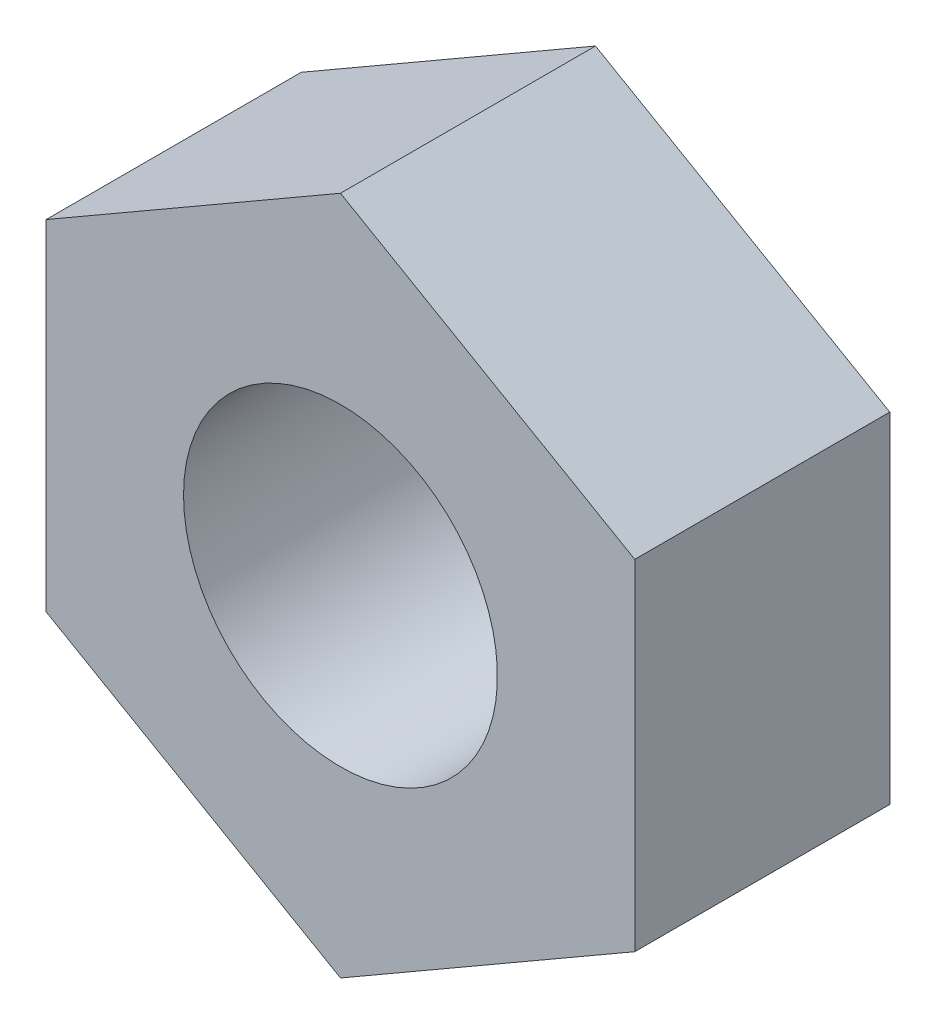
from build123d import *

# Parameters (mm, degrees)
SKETCH1_R           = 8
BOSS_EXTRUDE1_DEPTH = 13


with BuildPart() as part:
    # Sketch1 → Boss-Extrude1 (new body)
    with BuildSketch(Plane.XY):
        Polygon((15, -8.660254038), (15, 8.660254038), (0, 17.320508076), (-15, 8.660254038), (-15, -8.660254038), (0, -17.320508076), align=None)
        with Locations(Location((0, 0, 0), (0, 0, 180))):
            Circle(SKETCH1_R, mode=Mode.SUBTRACT)
    extrude(amount=BOSS_EXTRUDE1_DEPTH)


solid = part.part
